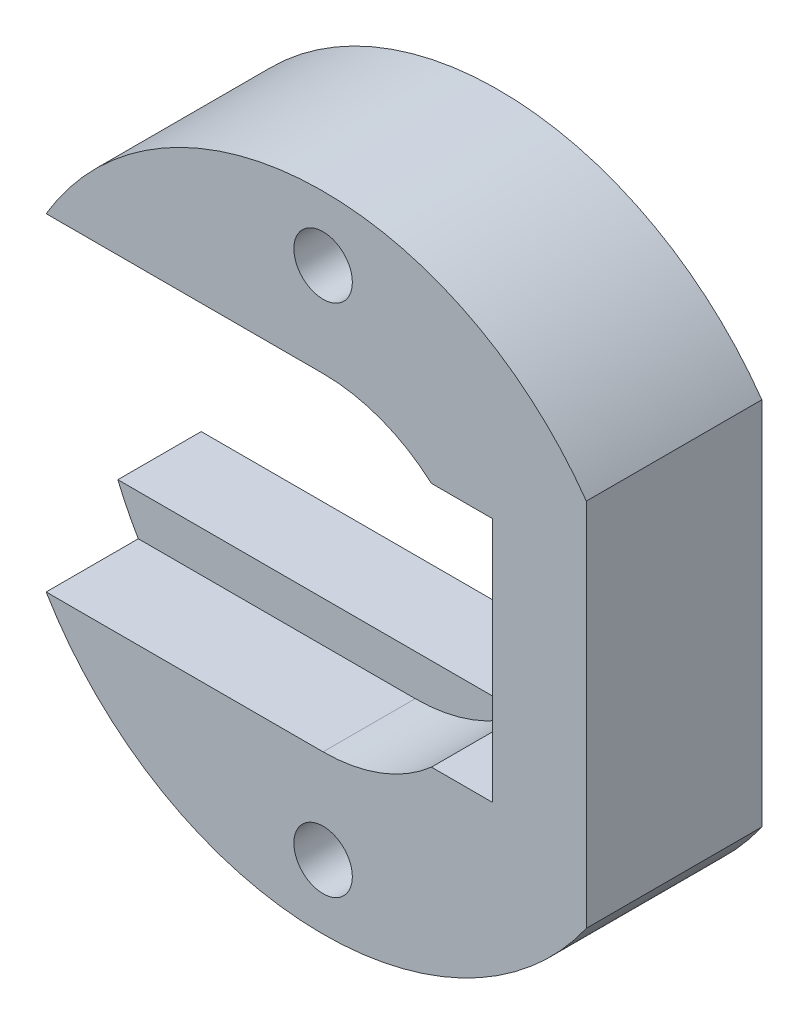
from build123d import *

# Parameters (mm, degrees)
SKETCH1_R               = 34.925
BOSS_EXTRUDE1_DEPTH     = 19.05
SKETCH2_W               = 106.68
SKETCH2_H               = 26.67
CUT_EXTRUDE1_DEPTH      = 19.05
SKETCH4_W               = 76.2
SKETCH4_H               = 35.56
CUT_EXTRUDE2_DEPTH      = 10
SKETCH5_R               = 17.78
CUT_EXTRUDE3_DEPTH      = 10
CUT_EXTRUDE4_DEPTH      = 53.937829102
CUT_EXTRUDE4_DEPTH_BACK = 53.937829102
SKETCH6_R               = 3.175
CUT_EXTRUDE5_DEPTH      = 53.937829102
CUT_EXTRUDE5_DEPTH_BACK = 53.937829102
SKETCH7_W               = 12.7
SKETCH7_H               = 106.569119896


with BuildPart() as part:
    # Sketch1 → Boss-Extrude1 (new body)
    with BuildSketch(Plane.XY):
        with Locations(Location((0, 0, 0), (0, 0, 180))):
            Circle(SKETCH1_R)
    extrude(amount=BOSS_EXTRUDE1_DEPTH)

    # Sketch2 → Cut-Extrude1 (cut)
    with BuildSketch(Plane.XY.offset(19.05)):
        with Locations((-34.925, 0)):
            Rectangle(SKETCH2_W, SKETCH2_H)
    extrude(amount=-CUT_EXTRUDE1_DEPTH, mode=Mode.SUBTRACT)

    # Sketch4 → Cut-Extrude2 (cut)
    with BuildSketch(Plane.XY.offset(19.05)):
        with Locations((-38.1, 0)):
            Rectangle(SKETCH4_W, SKETCH4_H)
    extrude(amount=-CUT_EXTRUDE2_DEPTH, mode=Mode.SUBTRACT)

    # Sketch5 → Cut-Extrude3 (cut)
    with BuildSketch(Plane.XY.offset(19.05)):
        Circle(SKETCH5_R)
    extrude(amount=-CUT_EXTRUDE3_DEPTH, mode=Mode.SUBTRACT)

    # Sketch6 → Cut-Extrude4 (cut, two sides: drawn at the far end of the back side and taken through both)
    with BuildSketch(Plane.XY.offset(19.05).offset(-CUT_EXTRUDE4_DEPTH_BACK)):
        with Locations((0, 27.94)):
            Circle(SKETCH6_R)
        with Locations((0, -27.94)):
            Circle(SKETCH6_R)
    extrude(amount=CUT_EXTRUDE4_DEPTH + CUT_EXTRUDE4_DEPTH_BACK, mode=Mode.SUBTRACT)

    # Sketch7 → Cut-Extrude5 (cut, two sides: drawn at the far end of the back side and taken through both)
    with BuildSketch(Plane.XY.offset(19.05).offset(-CUT_EXTRUDE5_DEPTH_BACK)):
        with Locations((34.925, 0)):
            Rectangle(SKETCH7_W, SKETCH7_H)
    extrude(amount=CUT_EXTRUDE5_DEPTH + CUT_EXTRUDE5_DEPTH_BACK, mode=Mode.SUBTRACT)


solid = part.part
